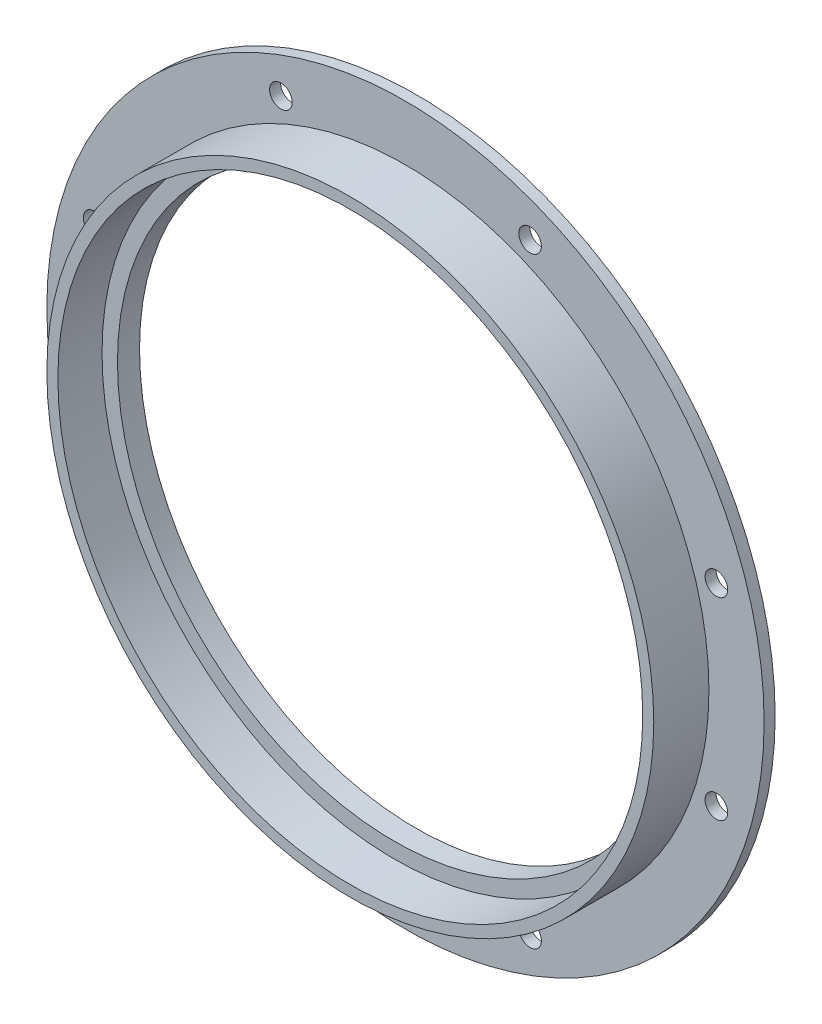
from build123d import *

# Parameters (mm, degrees)
SKETCH_1_R          = 65
SKETCH_1_R_2        = 50.2
SKETCH_1_R_3        = 0.5
EXTRUDE_1_DEPTH     = 10
SKETCH_2_R          = 53
CUT_EXTRUDE_1_DEPTH = 8
CUT_EXTRUDE_START   = -8
SKETCH_9_R          = 65
SKETCH_9_R_2        = 55
CUT_EXTRUDE_2_DEPTH = 8
SKETCH_11_R         = 65
SKETCH_11_R_2       = 55
CUT_EXTRUDE_4_DEPTH = 15
SKETCH_12_R         = 53
CUT_EXTRUDE_6_DEPTH = 15
SKETCH_13_R         = 55
SKETCH_13_R_2       = 50.2
EXTRUDE_2_DEPTH     = 2
EXTRUDE_START       = -2
SKETCH_14_R         = 65
SKETCH_14_R_2       = 2.05
SKETCH_14_R_3       = 50.2
EXTRUDE_3_DEPTH     = 2


with BuildPart() as part:
    # 草图1 → 凸台-拉伸1 (new body)
    with BuildSketch(Plane.XY):
        Circle(SKETCH_1_R)
        Circle(SKETCH_1_R_2, mode=Mode.SUBTRACT)
        with Locations((0, 59)):
            Circle(SKETCH_1_R_3, mode=Mode.SUBTRACT)
        with Locations((29.5, 51.095498823)):
            Circle(SKETCH_1_R_3, mode=Mode.SUBTRACT)
        with Locations((51.095498823, 29.5)):
            Circle(SKETCH_1_R_3, mode=Mode.SUBTRACT)
        with Locations((59, 0)):
            Circle(SKETCH_1_R_3, mode=Mode.SUBTRACT)
        with Locations((51.095498823, -29.5)):
            Circle(SKETCH_1_R_3, mode=Mode.SUBTRACT)
        with Locations((29.5, -51.095498823)):
            Circle(SKETCH_1_R_3, mode=Mode.SUBTRACT)
        with Locations((0, -59)):
            Circle(SKETCH_1_R_3, mode=Mode.SUBTRACT)
        with Locations((-29.5, -51.095498823)):
            Circle(SKETCH_1_R_3, mode=Mode.SUBTRACT)
        with Locations((-51.095498823, -29.5)):
            Circle(SKETCH_1_R_3, mode=Mode.SUBTRACT)
        with Locations((-59, 0)):
            Circle(SKETCH_1_R_3, mode=Mode.SUBTRACT)
        with Locations((-51.095498823, 29.5)):
            Circle(SKETCH_1_R_3, mode=Mode.SUBTRACT)
        with Locations((-29.5, 51.095498823)):
            Circle(SKETCH_1_R_3, mode=Mode.SUBTRACT)
    extrude(amount=EXTRUDE_1_DEPTH)

    # 草图2 → 切除-拉伸1 (cut)
    with BuildSketch(Plane(origin=(0, 0, 0), x_dir=(-1, 0, 0), z_dir=(0, 0, -1))):
        Circle(SKETCH_2_R)
    extrude(amount=-CUT_EXTRUDE_1_DEPTH, mode=Mode.SUBTRACT)

    # 草图9 → 切除-拉伸2 (cut)
    with BuildSketch(Plane.XY.offset(10).offset(CUT_EXTRUDE_START)):
        Circle(SKETCH_9_R)
        Circle(SKETCH_9_R_2, mode=Mode.SUBTRACT)
    extrude(amount=CUT_EXTRUDE_2_DEPTH, mode=Mode.SUBTRACT)

    # 草图11 → 切除-拉伸4 (cut, symmetric)
    with BuildSketch(Plane.XY.offset(2)):
        Circle(SKETCH_11_R)
        Circle(SKETCH_11_R_2, mode=Mode.SUBTRACT)
    extrude(amount=CUT_EXTRUDE_4_DEPTH, both=True, mode=Mode.SUBTRACT)

    # 草图12 → 切除-拉伸6 (cut, symmetric)
    with BuildSketch(Plane(origin=(0, 0, 8), x_dir=(-1, 0, 0), z_dir=(0, 0, -1))):
        Circle(SKETCH_12_R)
    extrude(amount=CUT_EXTRUDE_6_DEPTH, both=True, mode=Mode.SUBTRACT)

    # 草图13 → 凸台-拉伸2 (add, symmetric)
    with BuildSketch(Plane(origin=(0, 0, 0), x_dir=(-1, 0, 0), z_dir=(0, 0, -1))):
        with Locations(Location((0, 0, 0), (0, 0, 180))):
            Circle(SKETCH_13_R)
        Circle(SKETCH_13_R_2, mode=Mode.SUBTRACT)
    extrude(amount=EXTRUDE_2_DEPTH, both=True)

    # 草图14 → 凸台-拉伸3 (add)
    with BuildSketch(Plane(origin=(0, 0, -2), x_dir=(-1, 0, 0), z_dir=(0, 0, -1)).offset(EXTRUDE_START)):
        Circle(SKETCH_14_R)
        with Locations((22.57832251, 54.508892418)):
            Circle(SKETCH_14_R_2, mode=Mode.SUBTRACT)
        with Locations((22.57832251, -54.508892418)):
            Circle(SKETCH_14_R_2, mode=Mode.SUBTRACT)
        with Locations((-22.57832251, -54.508892418)):
            Circle(SKETCH_14_R_2, mode=Mode.SUBTRACT)
        with Locations((-22.57832251, 54.508892418)):
            Circle(SKETCH_14_R_2, mode=Mode.SUBTRACT)
        Circle(SKETCH_14_R_3, mode=Mode.SUBTRACT)
        with Locations((-56.344919913, 17.5)):
            Circle(SKETCH_14_R_2, mode=Mode.SUBTRACT)
        with Locations((-56.344919913, -17.5)):
            Circle(SKETCH_14_R_2, mode=Mode.SUBTRACT)
        with Locations((56.344919913, 17.5)):
            Circle(SKETCH_14_R_2, mode=Mode.SUBTRACT)
        with Locations((56.344919913, -17.5)):
            Circle(SKETCH_14_R_2, mode=Mode.SUBTRACT)
    extrude(amount=EXTRUDE_3_DEPTH)


solid = part.part
